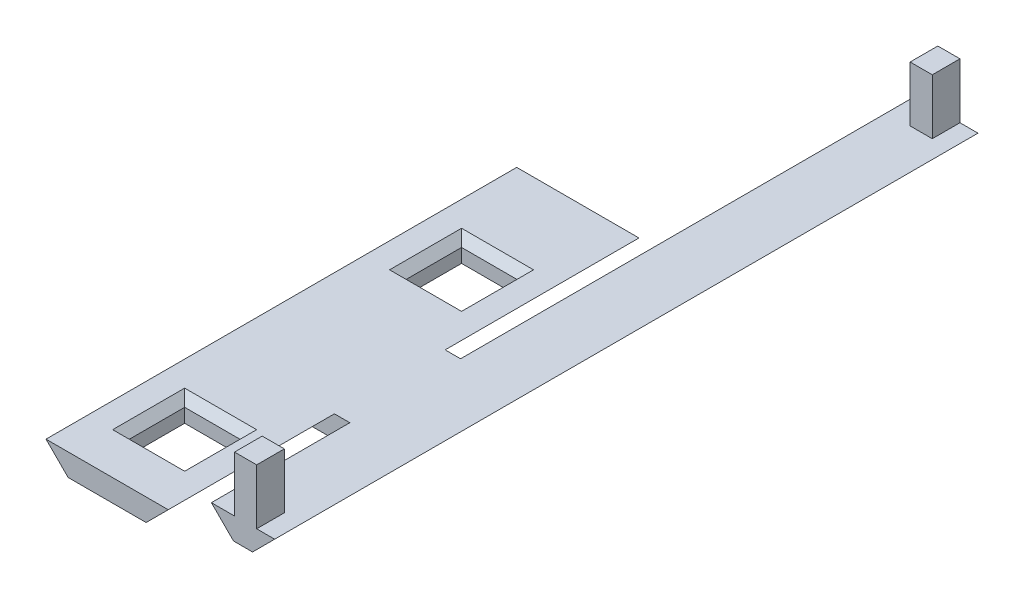
from build123d import *

# Parameters (mm, degrees)
DODANIE_WYCI_GNI_CIE1_DEPTH      = 85
SZKIC2_W                         = 10
SZKIC2_H                         = 10
WYTNIJ_WYCI_GNI_CIE1_DEPTH       = 80
DODANIE_WYCI_GNI_CIE3_DEPTH      = 80
DODANIE_WYCI_GNI_CIE3_DEPTH_BACK = 47
SZKIC4_W                         = 10.782842712
SZKIC4_H                         = 20
DODANIE_WYCI_GNI_CIE4_DEPTH      = 4
SZKIC5_W                         = 4
SZKIC5_H                         = 5
DODANIE_WYCI_GNI_CIE5_DEPTH      = 10
SZKIC6_W                         = 4
SZKIC6_H                         = 5
DODANIE_WYCI_GNI_CIE6_DEPTH      = 10
SFAZOWANIE1_SIZE                 = 1.5


with BuildPart() as part:
    # Szkic1 → Dodanie-wyciągnięcie1 (new body)
    with BuildSketch(Plane.XY):
        Polygon((7.5, 0), (11.5, 4), (-10.578691808, 4), (-6.578691808, 0), align=None)
    extrude(amount=DODANIE_WYCI_GNI_CIE1_DEPTH)

    # Szkic2 → Wytnij-wyciągnięcie1 (cut)
    with BuildSketch(Plane.XZ):
        with Locations((0.460654096, 21)):
            Rectangle(SZKIC2_W, SZKIC2_H)
        with Locations((0.460654096, 71)):
            Rectangle(SZKIC2_W, SZKIC2_H)
    extrude(amount=-WYTNIJ_WYCI_GNI_CIE1_DEPTH, mode=Mode.SUBTRACT)



with BuildPart() as body_2:
    # Szkic1<4> → Dodanie-wyciągnięcie3 (new, two sides: drawn at the far end of the back side and taken through both)
    with BuildSketch(Plane.XY.offset(-DODANIE_WYCI_GNI_CIE3_DEPTH_BACK)):
        Polygon((14.282842712, 4), (18.282842712, 0), (21.717157288, 0), (25.717157288, 4), align=None)
    extrude(amount=DODANIE_WYCI_GNI_CIE3_DEPTH + DODANIE_WYCI_GNI_CIE3_DEPTH_BACK)


with BuildPart() as part_1:
    add(part.part)

    add(body_2.part)  # Dodanie-wyciągnięcie4 merges body 2
    # Szkic4 → Dodanie-wyciągnięcie4 (add)
    with BuildSketch(Plane.XZ):
        with Locations((12.891421356, 45)):
            Rectangle(SZKIC4_W, SZKIC4_H)
    extrude(amount=-DODANIE_WYCI_GNI_CIE4_DEPTH)

    # Szkic5 → Dodanie-wyciągnięcie5 (add)
    with BuildSketch(Plane(origin=(0, 4, 0), x_dir=(1, 0, 0), z_dir=(0, 1, 0))):
        with Locations((20.460654096, -77.5)):
            Rectangle(SZKIC5_W, SZKIC5_H)
    extrude(amount=DODANIE_WYCI_GNI_CIE5_DEPTH)

    # Szkic6 → Dodanie-wyciągnięcie6 (add)
    with BuildSketch(Plane(origin=(0, 4, 0), x_dir=(1, 0, 0), z_dir=(0, 1, 0))):
        with Locations((20.460654096, 44.5)):
            Rectangle(SZKIC6_W, SZKIC6_H)
    extrude(amount=DODANIE_WYCI_GNI_CIE6_DEPTH)

    # Sfazowanie1
    sfazowanie1_edges = [part_1.edges().sort_by_distance(p)[0] for p in [
        (0.460654096, 4, 76),
        (-4.539345904, 4, 71),
        (0.460654096, 4, 66),
        (5.460654096, 4, 71),
        (0.460654096, 4, 26),
        (-4.539345904, 4, 21),
        (0.460654096, 4, 16),
        (5.460654096, 4, 21),
    ]]
    chamfer(sfazowanie1_edges, length=SFAZOWANIE1_SIZE)


solid = part_1.part
